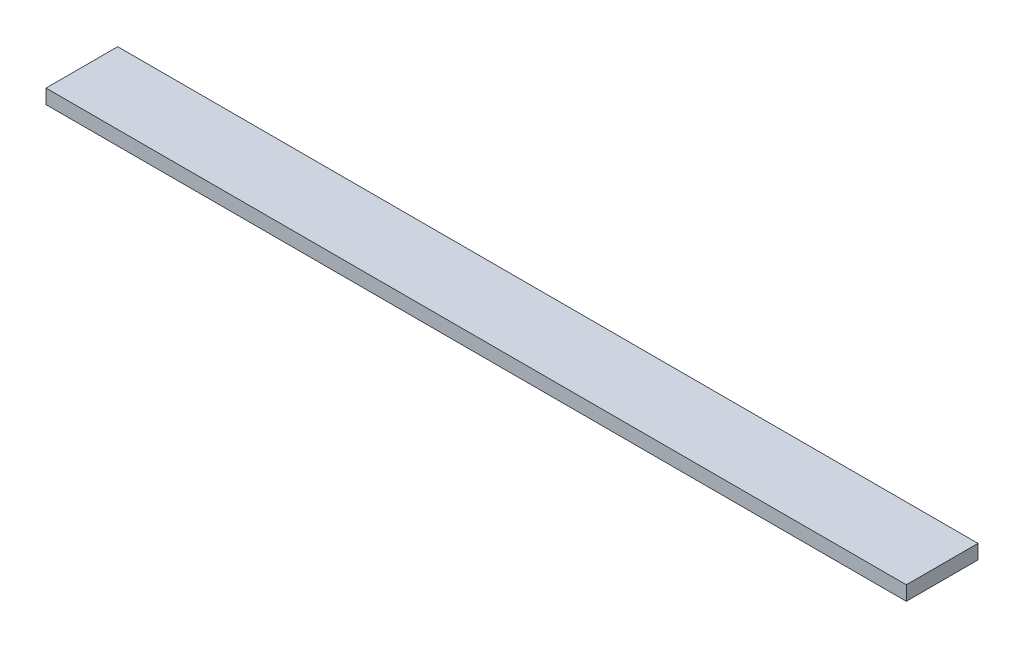
from build123d import *

# Parameters (mm, degrees)
SKETCH1_W           = 304.8
SKETCH1_H           = 25.4
BOSS_EXTRUDE1_DEPTH = 5.08


with BuildPart() as part:
    # Sketch1 → Boss-Extrude1 (new body)
    with BuildSketch(Plane(origin=(0, 0, 0), x_dir=(1, 0, 0), z_dir=(0, 1, 0))):
        Rectangle(SKETCH1_W, SKETCH1_H)
    extrude(amount=BOSS_EXTRUDE1_DEPTH)


solid = part.part
